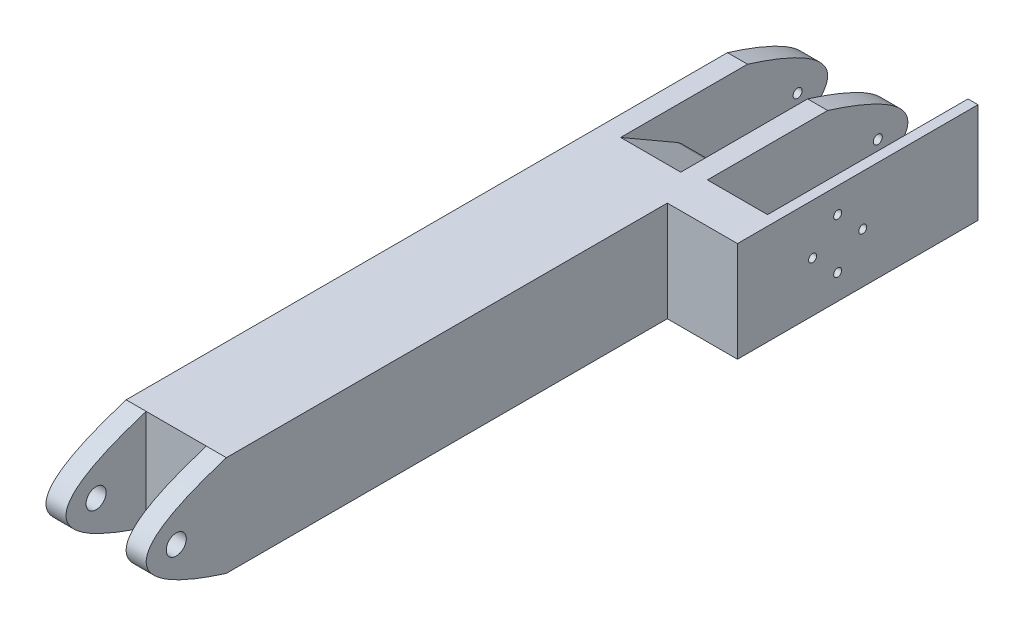
from build123d import *

# Parameters (mm, degrees)
SKETCH1_R               = 5
SKETCH1_R_2             = 2.25
BOSS_EXTRUDE1_DEPTH     = 50
CUT_EXTRUDE1_DEPTH      = 52
CUT_EXTRUDE1_DEPTH_BACK = 35
SKETCH2_W               = 30
SKETCH2_H               = 60
SKETCH3_W               = 30
SKETCH3_H               = 40
CUT_EXTRUDE2_DEPTH      = 52
CUT_EXTRUDE3_START      = -10
CUT_EXTRUDE3_DEPTH      = 30
CUT_EXTRUDE4_START      = -10
CUT_EXTRUDE4_DEPTH      = 30
BOSS_EXTRUDE2_DEPTH     = 50
SKETCH8_R               = 2
CUT_EXTRUDE5_DEPTH      = 10
FILLET1_R               = 10


with BuildPart() as part:
    # Sketch1 → Boss-Extrude1 (new body)
    with BuildSketch(Plane(origin=(0, 0, 0), x_dir=(0, 0, -1), z_dir=(1, 0, 0))):
        with BuildLine():
            Line((-255.87149894, 42.046001407), (44.12850106, 42.046001407))
            add(Edge.make_bspline(
                [(44.12850106, 42.046001407), (124.12850106, 17.046001407), (44.12850106, -7.953998593)],
                knots=[0, 0, 0, 1, 1, 1], degree=2))
            Line((44.12850106, -7.953998593), (-255.87149894, -7.953998593))
            add(Edge.make_bspline(
                [(-255.87149894, 42.046001407), (-335.87149894, 17.046001407), (-255.87149894, -7.953998593)],
                knots=[0, 0, 0, 1, 1, 1], degree=2))
        make_face()
        with Locations((-280.87149894, 17.046001407)):
            Circle(SKETCH1_R, mode=Mode.SUBTRACT)
        with Locations((69.12850106, 17.046001407)):
            Circle(SKETCH1_R_2, mode=Mode.SUBTRACT)
    extrude(amount=BOSS_EXTRUDE1_DEPTH)

    # Sketch2 → Cut-Extrude1 (cut, two sides: drawn at the far end of the back side and taken through both)
    with BuildSketch(Plane(origin=(0, 0, 0), x_dir=(1, 0, 0), z_dir=(0, 1, 0)).offset(-CUT_EXTRUDE1_DEPTH_BACK)):
        with Locations((25, 54.12850106)):
            Rectangle(SKETCH2_W, SKETCH2_H)
    extrude(amount=CUT_EXTRUDE1_DEPTH + CUT_EXTRUDE1_DEPTH_BACK, mode=Mode.SUBTRACT)

    # Sketch3 → Cut-Extrude2 (cut)
    with BuildSketch(Plane.XZ.offset(7.953998593)):
        with Locations((25, 275.87149894)):
            Rectangle(SKETCH3_W, SKETCH3_H)
    extrude(amount=-CUT_EXTRUDE2_DEPTH, mode=Mode.SUBTRACT)

    # Sketch4 → Cut-Extrude3 (cut)
    with BuildSketch(Plane.ZY.offset(CUT_EXTRUDE3_START)):
        Polygon((-24.12850106, 17.046001407), (-24.12850106, 42.046001407), (19.172769129, 42.046001407), align=None)
    extrude(amount=-CUT_EXTRUDE3_DEPTH, mode=Mode.SUBTRACT)

    # Sketch5 → Cut-Extrude4 (cut)
    with BuildSketch(Plane.ZY.offset(CUT_EXTRUDE4_START)):
        Polygon((-24.12850106, -7.953998593), (-24.12850106, 17.046001407), (19.172769129, -7.953998593), align=None)
    extrude(amount=-CUT_EXTRUDE4_DEPTH, mode=Mode.SUBTRACT)

    # Sketch6 → Boss-Extrude2 (add)
    with BuildSketch(Plane(origin=(0, 42.046001407, 0), x_dir=(1, 0, 0), z_dir=(0, 1, 0))):
        Polygon((50, -35.87149894), (85, -35.87149894), (85, 84.12850106), (80, 84.12850106), (80, -15.87149894), (50, -15.87149894), align=None)
    extrude(amount=-BOSS_EXTRUDE2_DEPTH)

    # Sketch8 → Cut-Extrude5 (cut)
    with BuildSketch(Plane(origin=(85, 0, 0), x_dir=(0, 0, -1), z_dir=(1, 0, 0))):
        with Locations((14.12850106, 29.546001407)):
            Circle(SKETCH8_R)
        with Locations((26.62850106, 17.046001407)):
            Circle(SKETCH8_R)
        with Locations((14.12850106, 4.546001407)):
            Circle(SKETCH8_R)
        with Locations((1.62850106, 17.046001407)):
            Circle(SKETCH8_R)
    extrude(amount=-CUT_EXTRUDE5_DEPTH, mode=Mode.SUBTRACT)

    # Fillet1
    fillet1_edges = [part.edges().sort_by_distance(p)[0] for p in [
        (25, 17.046001407, -24.12850106),
    ]]
    fillet(fillet1_edges, radius=FILLET1_R)


solid = part.part
